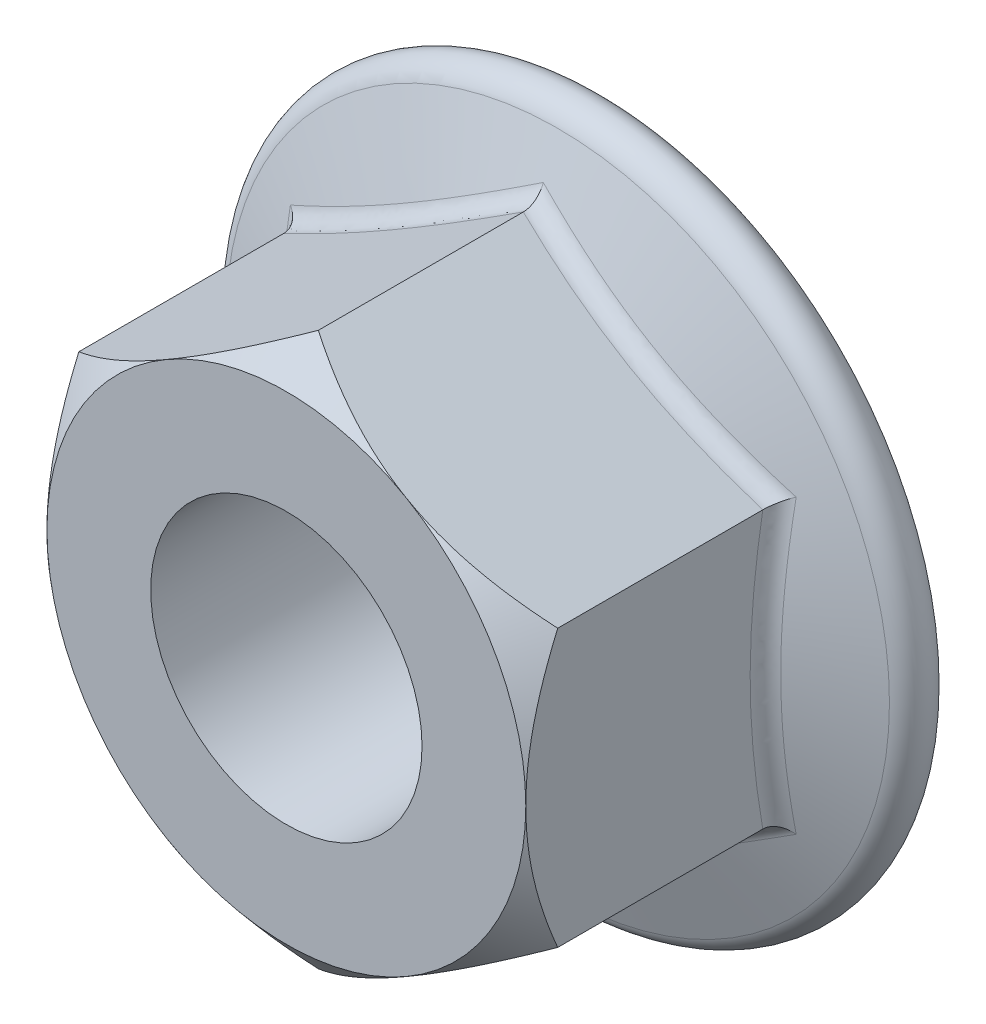
from build123d import *

# Parameters (mm, degrees)
BASENUTSKE_R   = 4.25
BASENUT_DEPTH  = 10
FLANGEFILLET_R = 0.6


with BuildPart() as part:
    # BaseNutSke → BaseNut (new body)
    with BuildSketch(Plane.XY):
        Polygon((7.5, 4.330127019), (7.5, -4.330127019), (0, -8.660254038), (-7.5, -4.330127019), (-7.5, 4.330127019), (0, 8.660254038), align=None)
        Circle(BASENUTSKE_R, mode=Mode.SUBTRACT)
    extrude(amount=-BASENUT_DEPTH)

    # Sketch6 → Flange (revolve)
    with BuildSketch(Plane(origin=(0, 0, 0), x_dir=(0, 0, -1), z_dir=(1, 0, 0)), mode=Mode.PRIVATE) as flange_sk:
        with BuildLine():
            Line((6.264796164, 4.25), (8.5, 10.391172068))
            ThreePointArc((8.5, 10.391172068), (9.360966928, 10.888251556), (10, 10.126681597))
            Line((10, 10.126681597), (10, 4.25))
            Line((10, 4.25), (6.264796164, 4.25))
        make_face()
    revolve(flange_sk.sketch.rotate(Axis((0, 0, 0), (0, 0, -1)), 90), axis=Axis((0, 0, 0), (0, 0, -1)))

    # Sketch3 → Double-Chamfer (revolve, cut)
    with BuildSketch(Plane(origin=(0, 0, 0), x_dir=(0, 0, -1), z_dir=(1, 0, 0)), mode=Mode.PRIVATE) as double_chamfer_sk:
        Polygon((1, 21.360254038), (-12.7, 21.360254038), (-12.7, 7.5), (0, 7.5), (1, 8.660254038), align=None)
    revolve(double_chamfer_sk.sketch.rotate(Axis((0, 0, 0), (0, 0, -1)), 90), axis=Axis((0, 0, 0), (0, 0, -1)), mode=Mode.SUBTRACT)

    # FlangeFillet
    flangefillet_edges = [part.edges().sort_by_distance(p)[0] for p in [
        (7.5, -2.17450822, -7.560119735),
        (7.5, 2.17450822, -7.560119735),
        (3.75, -6.495190528, -7.447699425),
        (3.75, 6.495190528, -7.447699425),
        (-3.75, 6.495190528, -7.447699425),
        (-7.5, 0, -7.447699425),
        (-3.75, -6.495190528, -7.447699425),
    ]]
    fillet(flangefillet_edges, radius=FLANGEFILLET_R)


solid = part.part
